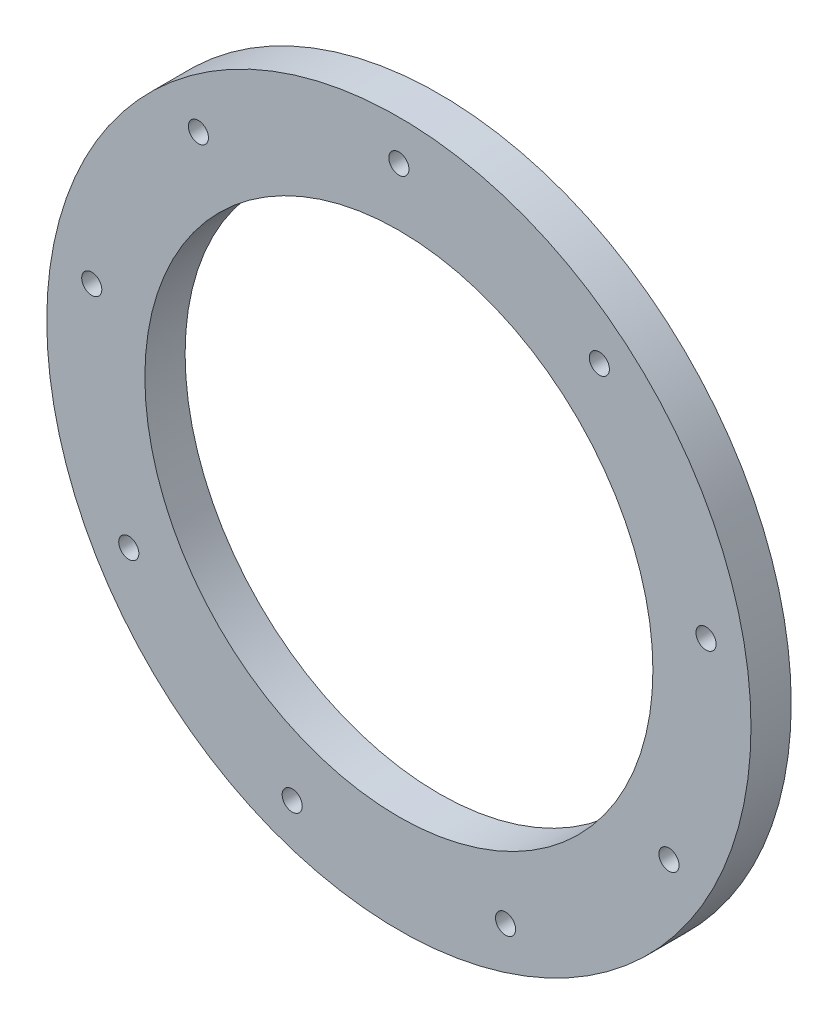
from build123d import *

# Parameters (mm, degrees)
SKETCH_2_R      = 70
SKETCH_2_R_2    = 50.5
SKETCH_2_R_3    = 2
EXTRUDE_1_DEPTH = 8


with BuildPart() as part:
    # 草图2 → 凸台-拉伸1 (new body)
    with BuildSketch(Plane.XY):
        Circle(SKETCH_2_R)
        Circle(SKETCH_2_R_2, mode=Mode.SUBTRACT)
        with Locations((0, 62)):
            Circle(SKETCH_2_R_3, mode=Mode.SUBTRACT)
        with Locations((39.852831801, 47.494755473)):
            Circle(SKETCH_2_R_3, mode=Mode.SUBTRACT)
        with Locations((61.058080687, 10.766187015)):
            Circle(SKETCH_2_R_3, mode=Mode.SUBTRACT)
        with Locations((53.693575035, -31)):
            Circle(SKETCH_2_R_3, mode=Mode.SUBTRACT)
        with Locations((21.205248886, -58.260942489)):
            Circle(SKETCH_2_R_3, mode=Mode.SUBTRACT)
        with Locations((-21.205248886, -58.260942489)):
            Circle(SKETCH_2_R_3, mode=Mode.SUBTRACT)
        with Locations((-53.693575035, -31)):
            Circle(SKETCH_2_R_3, mode=Mode.SUBTRACT)
        with Locations((-61.058080687, 10.766187015)):
            Circle(SKETCH_2_R_3, mode=Mode.SUBTRACT)
        with Locations((-39.852831801, 47.494755473)):
            Circle(SKETCH_2_R_3, mode=Mode.SUBTRACT)
    extrude(amount=EXTRUDE_1_DEPTH)


solid = part.part
